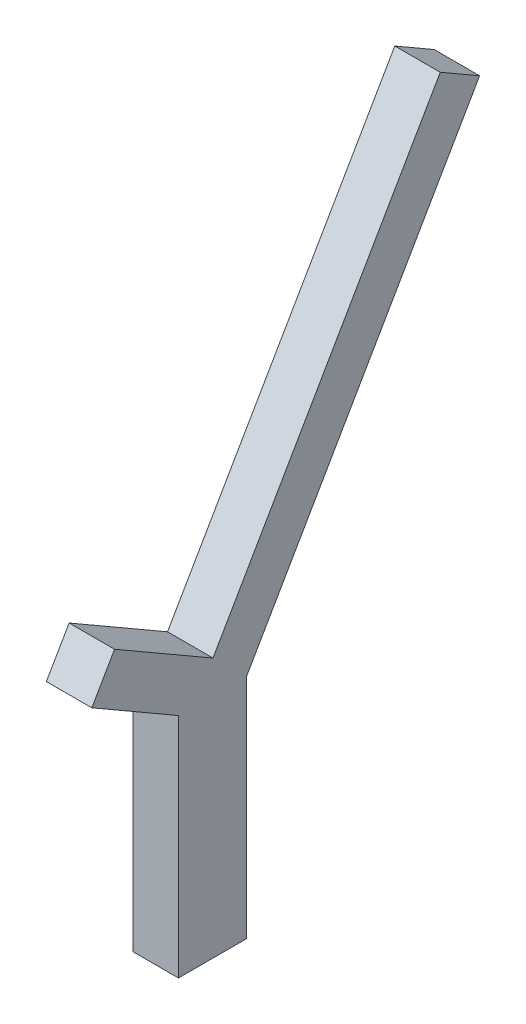
from build123d import *

# Parameters (mm, degrees)
BOSS_EXTRUDE1_DEPTH = 10


with BuildPart() as part:
    # Sketch1 → Boss-Extrude1 (new body)
    with BuildSketch(Plane(origin=(0, 0, 0), x_dir=(0, 0, -1), z_dir=(1, 0, 0))):
        Polygon((40.617165223, 76.27680134), (-9.382834777, -10.325739039), (-31.033469871, 2.174260961), (-36.033469871, -6.485993077), (-16.972580739, -17.490802548), (-16.972580739, -67.490802548), (-1.972580739, -67.490802548), (-1.972580739, -17.490802548), (49.277419261, 71.27680134), align=None)
    extrude(amount=BOSS_EXTRUDE1_DEPTH)


solid = part.part
